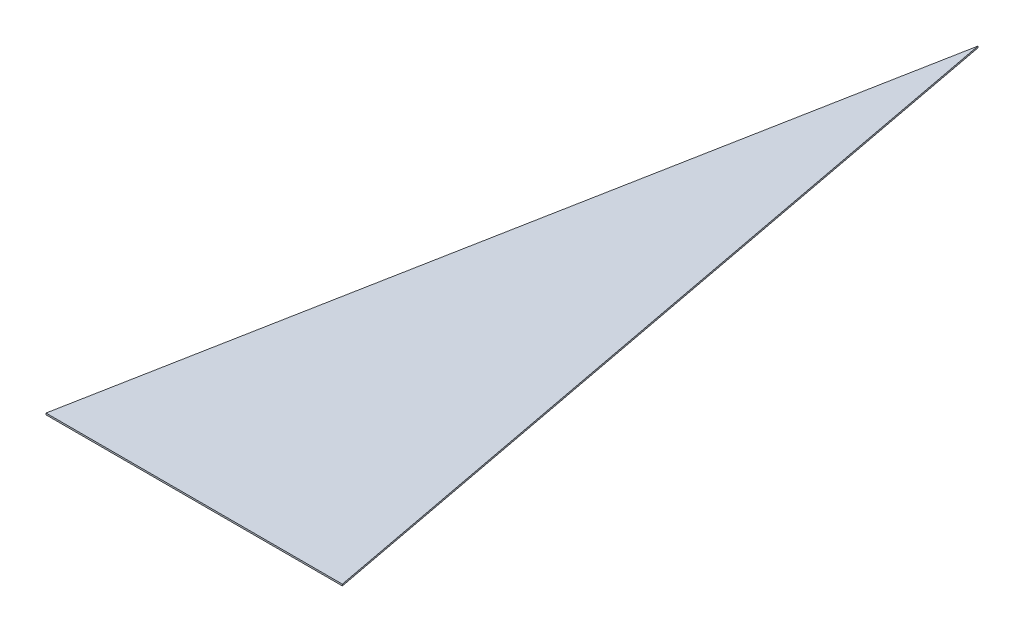
from build123d import *

# Parameters (mm, degrees)
BOSS_EXTRUDE1_DEPTH = 30.48


with BuildPart() as part:
    # Sketch7 → Boss-Extrude1 (new body)
    with BuildSketch(Plane(origin=(0, 0, 0), x_dir=(1, 0, 0), z_dir=(0, 1, 0))):
        Polygon((0, 12192), (2813.333243411, -2689.5552), (-2813.333243411, -2689.5552), align=None)
    extrude(amount=BOSS_EXTRUDE1_DEPTH)


solid = part.part
